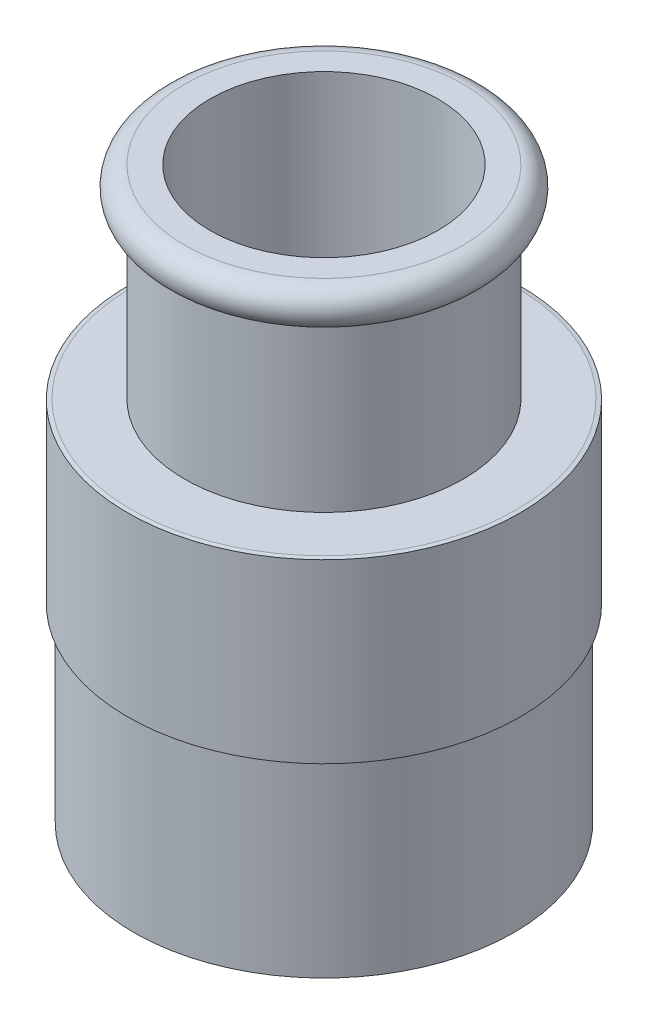
from build123d import *

# Parameters (mm, degrees)
CROQUIS1_W            = 6
CROQUIS1_H            = 15
CROQUIS2_R            = 4.41619294
CORTAR_EXTRUIR1_DEPTH = 46.572058325


with BuildPart() as part:
    # Croquis1 → Revolución1 (revolve)
    with BuildSketch(Plane.XY):
        with BuildLine():
            Line((7.75, -7.051316702), (7.433772234, -7))
            Line((7.433772234, -7), (3.25, -7))
            Line((3.25, -7), (3.25, 6))
            ThreePointArc((3.25, 6), (4.75, 7.5), (3.25, 9))
            Line((3.25, 9), (1.25, 9))
            Line((1.25, 9), (1.25, -9))
            Line((1.25, -9), (4.765255872, -9))
            Line((4.765255872, -9), (7.75, -9))
            Line((7.75, -9), (7.75, -7.051316702))
        make_face()
        Polygon((7.75, -21), (7.75, -9), (4.765255872, -9), (1.25, -9), (1.25, -21), (7.25, -21), align=None)
        with Locations((4.25, -28.5)):
            Rectangle(CROQUIS1_W, CROQUIS1_H)
    revolve(axis=Axis((-7.75, -7, 0), (0, 1, 0)))

    # Croquis2 → Cortar-Extruir1 (cut, through all)
    with BuildSketch(Plane.XY):
        with Locations((-7.75, -14.025658351)):
            Circle(CROQUIS2_R)
    extrude(amount=-CORTAR_EXTRUIR1_DEPTH, mode=Mode.SUBTRACT)


solid = part.part
